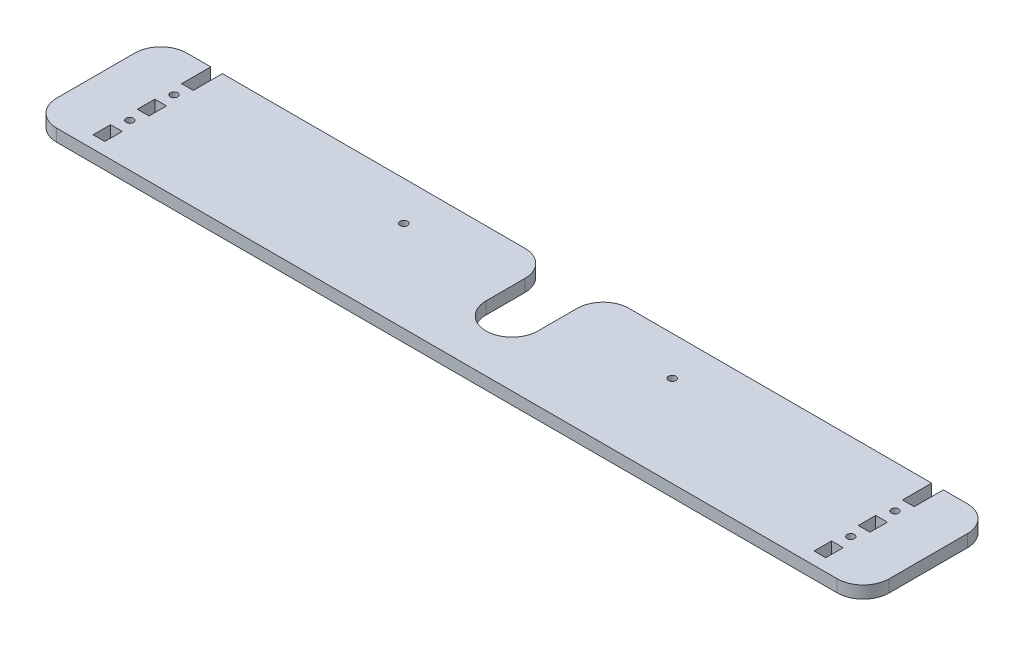
from build123d import *

# Parameters (mm, degrees)
SKETCH1_W           = 5.7
SKETCH1_H           = 8.509
SKETCH1_R           = 1.778
SKETCH1_R_2         = 1.8288
BOSS_EXTRUDE1_DEPTH = 6


with BuildPart() as part:
    # Sketch1 → Boss-Extrude1 (new body)
    with BuildSketch(Plane(origin=(0, 0, 0), x_dir=(1, 0, 0), z_dir=(0, 1, 0))):
        with BuildLine():
            ThreePointArc((-203.2, -19.05), (-199.480256121, -28.030256121), (-190.5, -31.75))
            Line((-190.5, -31.75), (190.5, -31.75))
            ThreePointArc((190.5, -31.75), (199.480256121, -28.030256121), (203.2, -19.05))
            Line((203.2, -19.05), (203.2, 19.05))
            ThreePointArc((203.2, 19.05), (199.480256121, 28.030256121), (190.5, 31.75))
            Line((190.5, 31.75), (178.816, 31.75))
            Line((178.816, 31.75), (178.816, 26.035))
            Line((178.816, 26.035), (178.816, 17.526))
            Line((178.816, 17.526), (173.116, 17.526))
            Line((173.116, 17.526), (173.116, 26.035))
            Line((173.116, 26.035), (173.116, 31.75))
            Line((173.116, 31.75), (25.4, 31.75))
            ThreePointArc((25.4, 31.75), (16.419743879, 28.030256121), (12.7, 19.05))
            Line((12.7, 19.05), (12.7, 0))
            ThreePointArc((12.7, 0), (0, -12.7), (-12.7, 0))
            Line((-12.7, 0), (-12.7, 19.05))
            ThreePointArc((-12.7, 19.05), (-16.419743879, 28.030256121), (-25.4, 31.75))
            Line((-25.4, 31.75), (-173.116, 31.75))
            Line((-173.116, 31.75), (-173.116, 26.035))
            Line((-173.116, 26.035), (-173.116, 17.526))
            Line((-173.116, 17.526), (-178.816, 17.526))
            Line((-178.816, 17.526), (-178.816, 26.035))
            Line((-178.816, 26.035), (-178.816, 31.75))
            Line((-178.816, 31.75), (-190.5, 31.75))
            ThreePointArc((-190.5, 31.75), (-199.480256121, 28.030256121), (-203.2, 19.05))
            Line((-203.2, 19.05), (-203.2, -19.05))
        make_face()
        with Locations((-175.966, -21.3995)):
            Rectangle(SKETCH1_W, SKETCH1_H, mode=Mode.SUBTRACT)
        with Locations(Location((-175.966, -10.6045, 0), (0, 0, 270))):
            Circle(SKETCH1_R, mode=Mode.SUBTRACT)
        with Locations((175.966, -21.3995)):
            Rectangle(SKETCH1_W, SKETCH1_H, mode=Mode.SUBTRACT)
        with Locations(Location((175.966, -10.6045, 0), (0, 0, 270))):
            Circle(SKETCH1_R, mode=Mode.SUBTRACT)
        with Locations((-175.966, 0.1905)):
            Rectangle(SKETCH1_W, SKETCH1_H, mode=Mode.SUBTRACT)
        with Locations(Location((-175.966, 10.9855, 0), (0, 0, 270))):
            Circle(SKETCH1_R, mode=Mode.SUBTRACT)
        with Locations(Location((-65.5, 12.7, 0), (0, 0, 270))):
            Circle(SKETCH1_R_2, mode=Mode.SUBTRACT)
        with Locations(Location((65.5, 12.7, 0), (0, 0, 270))):
            Circle(SKETCH1_R_2, mode=Mode.SUBTRACT)
        with Locations((175.966, 0.1905)):
            Rectangle(SKETCH1_W, SKETCH1_H, mode=Mode.SUBTRACT)
        with Locations(Location((175.966, 10.9855, 0), (0, 0, 270))):
            Circle(SKETCH1_R, mode=Mode.SUBTRACT)
    extrude(amount=BOSS_EXTRUDE1_DEPTH)


solid = part.part
